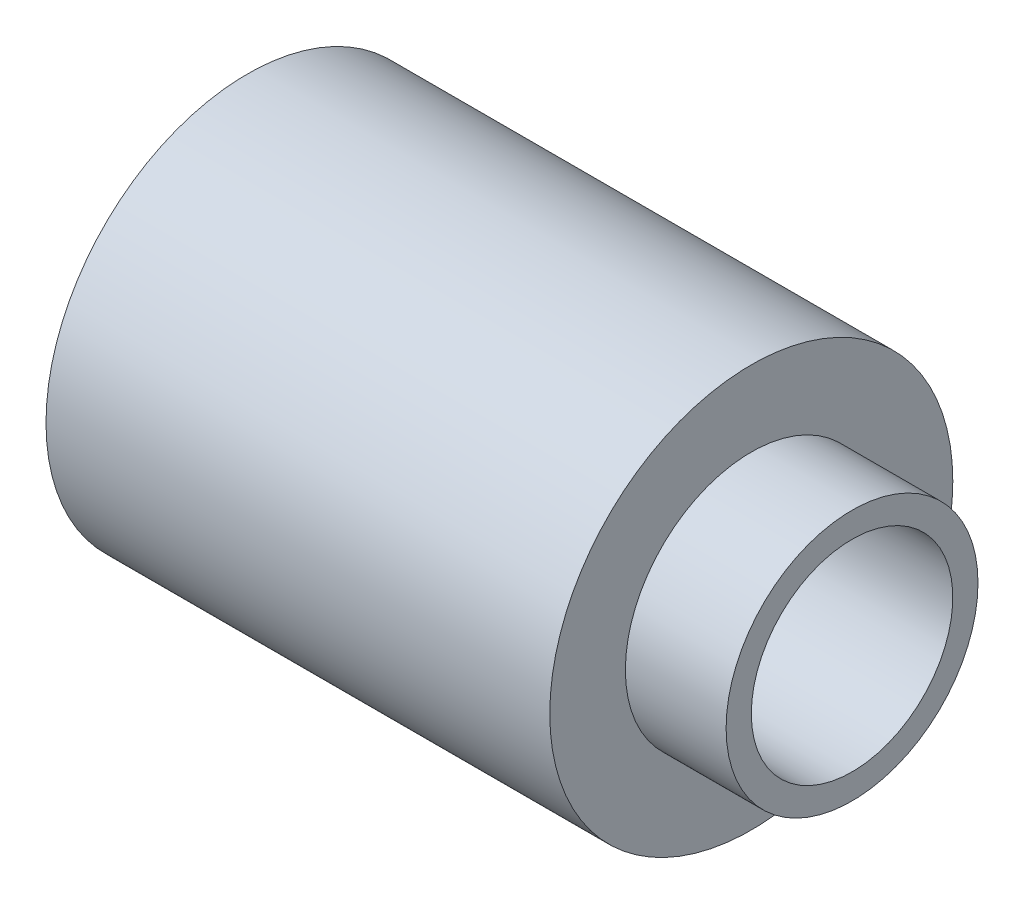
from build123d import *


with BuildPart() as part:
    # Sketch1 → Revolve1 (revolve)
    with BuildSketch(Plane.XY, mode=Mode.PRIVATE) as revolve1_sk:
        Polygon((-10, 2), (-10, 4), (0, 4), (0, 2.5), (2, 2.5), (2, 2), align=None)
    revolve(revolve1_sk.sketch.rotate(Axis((-4.772765662, 0, 0), (1, 0, 0)), 90), axis=Axis((-4.772765662, 0, 0), (1, 0, 0)))


solid = part.part
